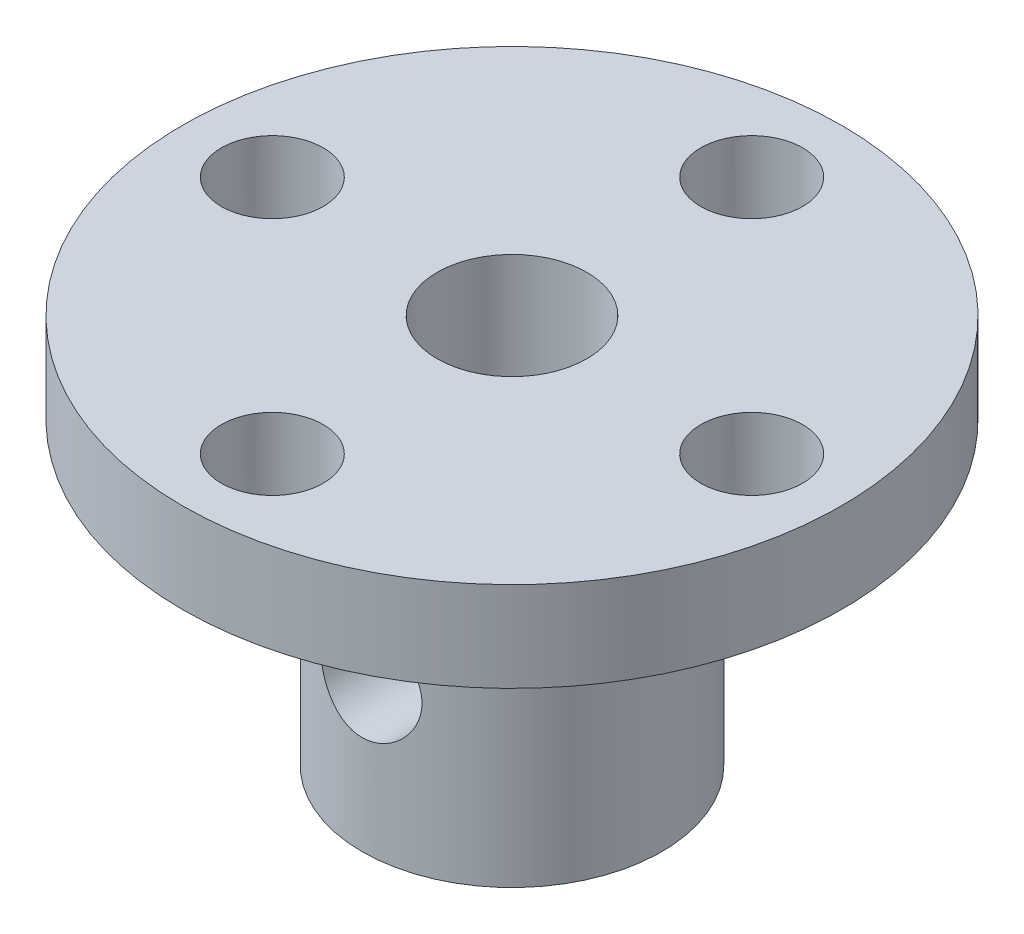
from build123d import *

# Parameters (mm, degrees)
SKETCH_2_R               = 1.7
CUT_EXTRUDE_1_DEPTH      = 10
CUT_EXTRUDE_2_DEPTH      = 21.273134933
CUT_EXTRUDE_2_DEPTH_BACK = 21.273134933
SKETCH_3_R               = 1.7


with BuildPart() as part:
    # 草图1 → 旋转1 (revolve)
    with BuildSketch(Plane.XY, mode=Mode.PRIVATE) as revolve_1_sk:
        Polygon((-2.5, 0), (-11, 0), (-11, -3), (-5, -3), (-5, -13), (-2.5, -13), align=None)
    revolve(revolve_1_sk.sketch.rotate(Axis((0, 0, 0), (0, -1, 0)), 270), axis=Axis((0, 0, 0), (0, -1, 0)))

    # 草图2 → 切除-拉伸1 (cut)
    with BuildSketch(Plane(origin=(0, 0, 0), x_dir=(1, 0, 0), z_dir=(0, 1, 0))):
        with Locations(Location((0, 8, 0), (0, 0, 270))):
            Circle(SKETCH_2_R)
        with Locations(Location((8, 0, 0), (0, 0, 270))):
            Circle(SKETCH_2_R)
        with Locations(Location((0, -8, 0), (0, 0, 270))):
            Circle(SKETCH_2_R)
        with Locations(Location((-8, 0, 0), (0, 0, 270))):
            Circle(SKETCH_2_R)
    extrude(amount=-CUT_EXTRUDE_1_DEPTH, mode=Mode.SUBTRACT)

    # 草图3 → 切除-拉伸2 (cut, two sides: drawn at the far end of the back side and taken through both)
    with BuildSketch(Plane.XY.offset(-CUT_EXTRUDE_2_DEPTH_BACK)):
        with Locations((0, -8)):
            Circle(SKETCH_3_R)
    extrude(amount=CUT_EXTRUDE_2_DEPTH + CUT_EXTRUDE_2_DEPTH_BACK, mode=Mode.SUBTRACT)


solid = part.part
